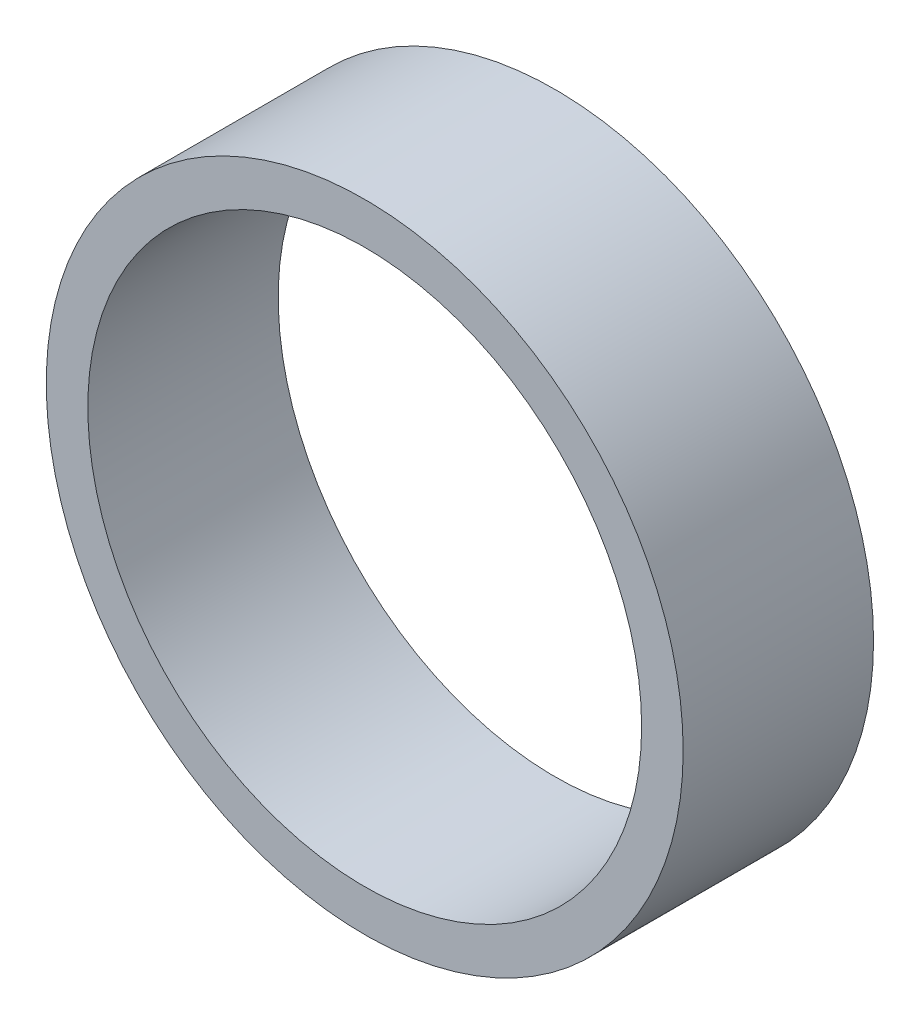
from build123d import *

# Parameters (mm, degrees)
SKETCH_1_R      = 9.2
SKETCH_1_R_2    = 8
EXTRUDE_1_DEPTH = 5.5


with BuildPart() as part:
    # Эскиз1 → Бобышка-Вытянуть1 (new body)
    with BuildSketch(Plane.XY):
        Circle(SKETCH_1_R)
        Circle(SKETCH_1_R_2, mode=Mode.SUBTRACT)
    extrude(amount=EXTRUDE_1_DEPTH)


solid = part.part
